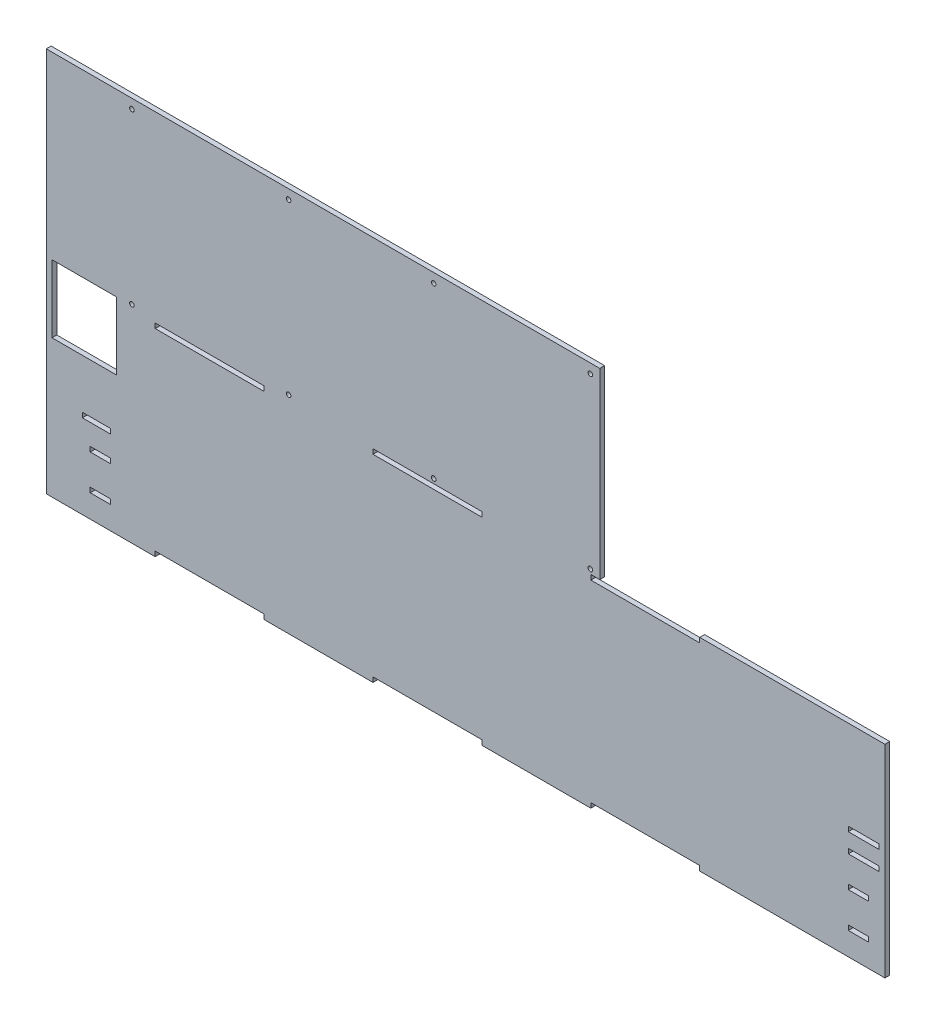
from build123d import *

# Parameters (mm, degrees)
SKETCH1_R           = 1.5
SKETCH1_W           = 71.428571428
SKETCH1_H           = 3.175
SKETCH1_W_2         = 20
SKETCH1_W_3         = 13.333
SKETCH1_W_4         = 42.3
SKETCH1_H_2         = 44.35
SKETCH1_W_5         = 18.5
BOSS_EXTRUDE1_DEPTH = 3.175


with BuildPart() as part:
    # Sketch1 → Boss-Extrude1 (new body)
    with BuildSketch(Plane.XY):
        Polygon((0, 0), (0, 132.75), (0, 252.75), (328.222222222, 252.75), (363, 252.75), (363, 228.115), (363, 132.75), (357.142857143, 132.75), (357.142857143, 129.575), (428.571428571, 129.575), (428.571428571, 132.75), (550, 132.75), (550, 0), (428.571428571, 0), (428.571428571, 3.175), (357.142857143, 3.175), (357.142857143, 0), (285.714285714, 0), (285.714285714, 3.175), (214.285714286, 3.175), (214.285714286, 0), (142.857142857, 0), (142.857142857, 3.175), (71.428571429, 3.175), (71.428571429, 0), align=None)
        with Locations((56.175, 246.575)):
            Circle(SKETCH1_R, mode=Mode.SUBTRACT)
        with Locations((158.920833333, 135.75)):
            Circle(SKETCH1_R, mode=Mode.SUBTRACT)
        with Locations((158.920833333, 246.575)):
            Circle(SKETCH1_R, mode=Mode.SUBTRACT)
        with Locations((254.079166667, 246.575)):
            Circle(SKETCH1_R, mode=Mode.SUBTRACT)
        with Locations((254.079166667, 135.75)):
            Circle(SKETCH1_R, mode=Mode.SUBTRACT)
        with Locations((356.825, 135.75)):
            Circle(SKETCH1_R, mode=Mode.SUBTRACT)
        with Locations((356.825, 246.575)):
            Circle(SKETCH1_R, mode=Mode.SUBTRACT)
        with Locations((56.175, 135.75)):
            Circle(SKETCH1_R, mode=Mode.SUBTRACT)
        with Locations((107.142857143, 131.1625)):
            Rectangle(SKETCH1_W, SKETCH1_H, mode=Mode.SUBTRACT)
        with Locations((250, 131.1625)):
            Rectangle(SKETCH1_W, SKETCH1_H, mode=Mode.SUBTRACT)
        with Locations((536, 60.0875)):
            Rectangle(SKETCH1_W_2, SKETCH1_H, mode=Mode.SUBTRACT)
        with Locations((536, 72.6625)):
            Rectangle(SKETCH1_W_2, SKETCH1_H, mode=Mode.SUBTRACT)
        with Locations((532.6665, 16.5875)):
            Rectangle(SKETCH1_W_3, SKETCH1_H, mode=Mode.SUBTRACT)
        with Locations((24.95, 112.68)):
            Rectangle(SKETCH1_W_4, SKETCH1_H_2, mode=Mode.SUBTRACT)
        with Locations((32.933020508, 56.5875)):
            Rectangle(SKETCH1_W_5, SKETCH1_H, mode=Mode.SUBTRACT)
        with Locations((35.516520508, 16.5875)):
            Rectangle(SKETCH1_W_3, SKETCH1_H, mode=Mode.SUBTRACT)
        with Locations((35.516520508, 39.7625)):
            Rectangle(SKETCH1_W_3, SKETCH1_H, mode=Mode.SUBTRACT)
        with Locations((532.6665, 39.7625)):
            Rectangle(SKETCH1_W_3, SKETCH1_H, mode=Mode.SUBTRACT)
    extrude(amount=BOSS_EXTRUDE1_DEPTH)


solid = part.part
